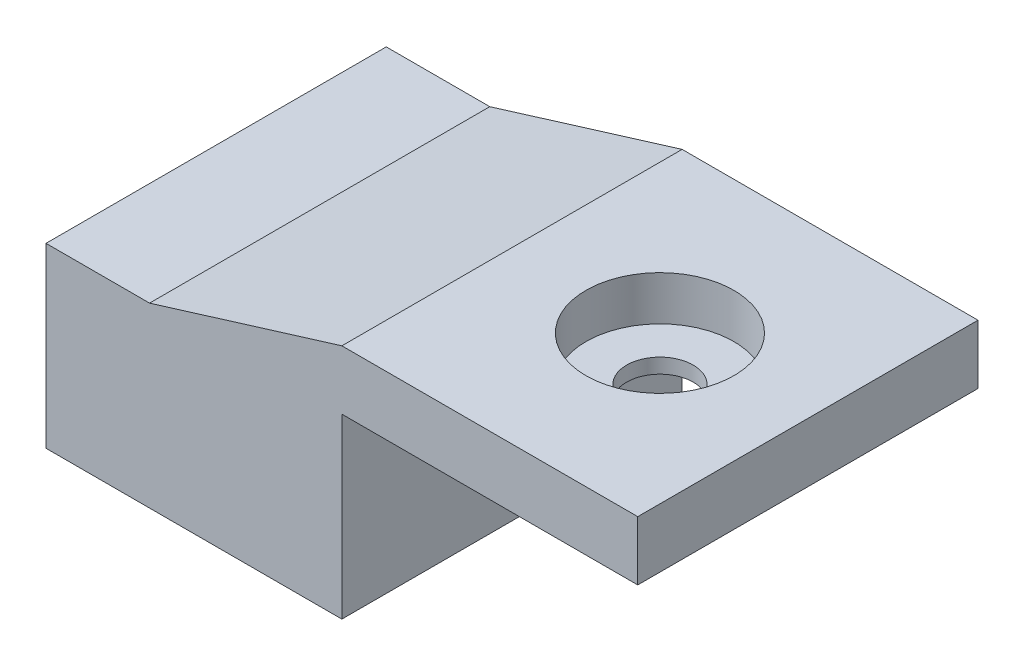
from build123d import *

# Parameters (mm, degrees)
ESTRUSIONE_ESTRUSIONE1_DEPTH                         = 23
FORO_PER_VITE_M4_1_D                                 = 5.6
FORO_PER_VITE_M4_1_DEPTH                             = 10
FORO_PER_VITE_M4_1_TIP                               = 1.682409733
FORO_LAMATO_PER_BULLONE_M5_A_TESTA_ESAGO_D           = 4.5
FORO_LAMATO_PER_BULLONE_M5_A_TESTA_ESAGO_DEPTH       = 10
FORO_LAMATO_PER_BULLONE_M5_A_TESTA_ESAGO_CBORE_D     = 10
FORO_LAMATO_PER_BULLONE_M5_A_TESTA_ESAGO_CBORE_DEPTH = 3
FORO_LAMATO_PER_BULLONE_M5_A_TESTA_ESAGO_TIP         = 1.351936393


with BuildPart() as part:
    # Schizzo1 → Estrusione-Estrusione1 (new body)
    with BuildSketch(Plane.XY):
        Polygon((0, 0), (20, 0), (20, 12), (40, 12), (40, 16), (20, 16), (7, 12), (0, 12), align=None)
    extrude(amount=ESTRUSIONE_ESTRUSIONE1_DEPTH)

    # Foro per Vite M4-1
    with Locations(Plane(origin=(0, 5.5, 5), x_dir=(0, -1, 0), z_dir=(-1, 0, 0))):
        with Locations((0, 0), (0, 13)):
            Hole(FORO_PER_VITE_M4_1_D / 2, depth=FORO_PER_VITE_M4_1_DEPTH)
            with Locations((0, 0, -(FORO_PER_VITE_M4_1_DEPTH + FORO_PER_VITE_M4_1_TIP / 2))):  # 118° drill point
                Cone(0, FORO_PER_VITE_M4_1_D / 2, FORO_PER_VITE_M4_1_TIP, mode=Mode.SUBTRACT)

    # Foro lamato per Bullone M5 a testa esagonale-1
    with Locations(Plane(origin=(0, 16, 0), x_dir=(1, 0, 0), z_dir=(0, 1, 0))):
        with Locations((30, -11.5)):
            CounterBoreHole(FORO_LAMATO_PER_BULLONE_M5_A_TESTA_ESAGO_D / 2, FORO_LAMATO_PER_BULLONE_M5_A_TESTA_ESAGO_CBORE_D / 2, FORO_LAMATO_PER_BULLONE_M5_A_TESTA_ESAGO_CBORE_DEPTH, depth=FORO_LAMATO_PER_BULLONE_M5_A_TESTA_ESAGO_DEPTH)
            with Locations((0, 0, -(FORO_LAMATO_PER_BULLONE_M5_A_TESTA_ESAGO_DEPTH + FORO_LAMATO_PER_BULLONE_M5_A_TESTA_ESAGO_TIP / 2))):  # 118° drill point
                Cone(0, FORO_LAMATO_PER_BULLONE_M5_A_TESTA_ESAGO_D / 2, FORO_LAMATO_PER_BULLONE_M5_A_TESTA_ESAGO_TIP, mode=Mode.SUBTRACT)


solid = part.part
